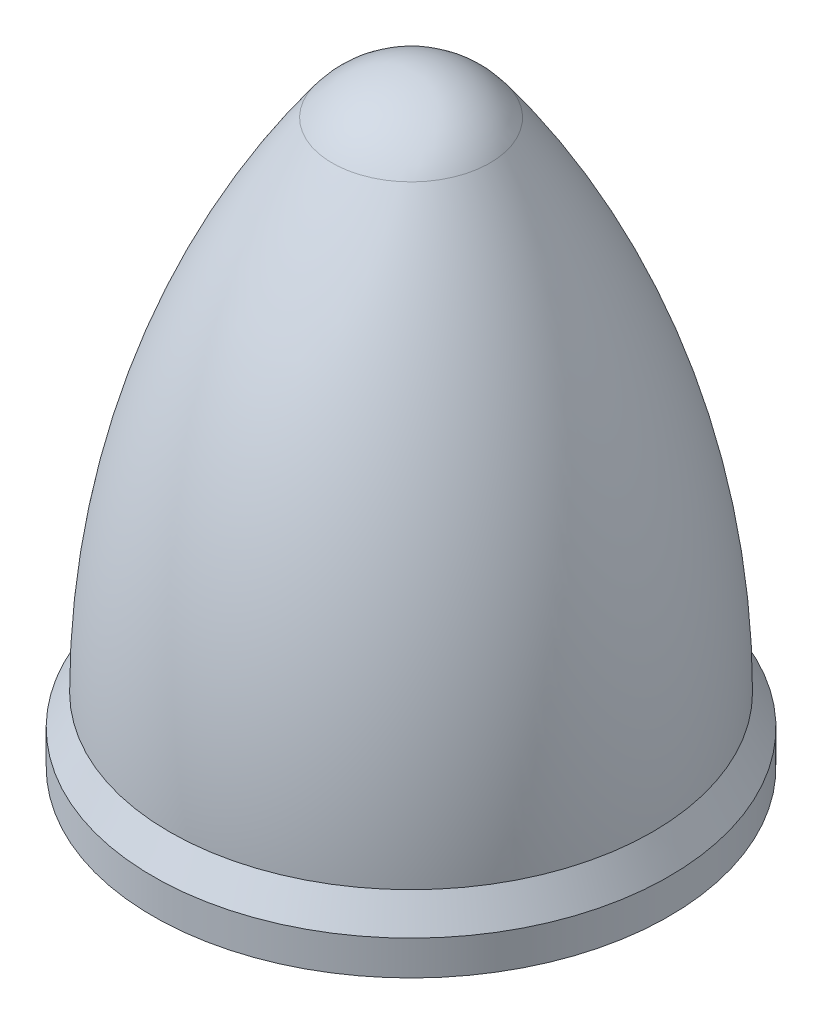
from build123d import *


with BuildPart() as part:
    # Sketch1 → Revolve1 (revolve)
    with BuildSketch(Plane(origin=(0, 0, 0), x_dir=(0, 0, -1), z_dir=(1, 0, 0))):
        with BuildLine():
            Line((2.8, 0), (2.8, 5.5))
            Line((2.8, 5.5), (0, 5.5))
            Line((0, 5.5), (0, 15.6))
            ThreePointArc((0, 15.6), (1.282121246, 15.293128453), (2.286366324, 14.439022569))
            ThreePointArc((2.286366324, 14.439022569), (5.791764957, 7.594466986), (7, 0))
            Line((7, 0), (7.480731787, -0.876867692))
            Line((7.480731787, -0.876867692), (7.480731787, -1.876867692))
            Line((7.480731787, -1.876867692), (2.8, -1.876867692))
            Line((2.8, -1.876867692), (2.8, 0))
        make_face()
    revolve(axis=Axis((0, 5.5, 0), (0, 1, 0)))


solid = part.part
